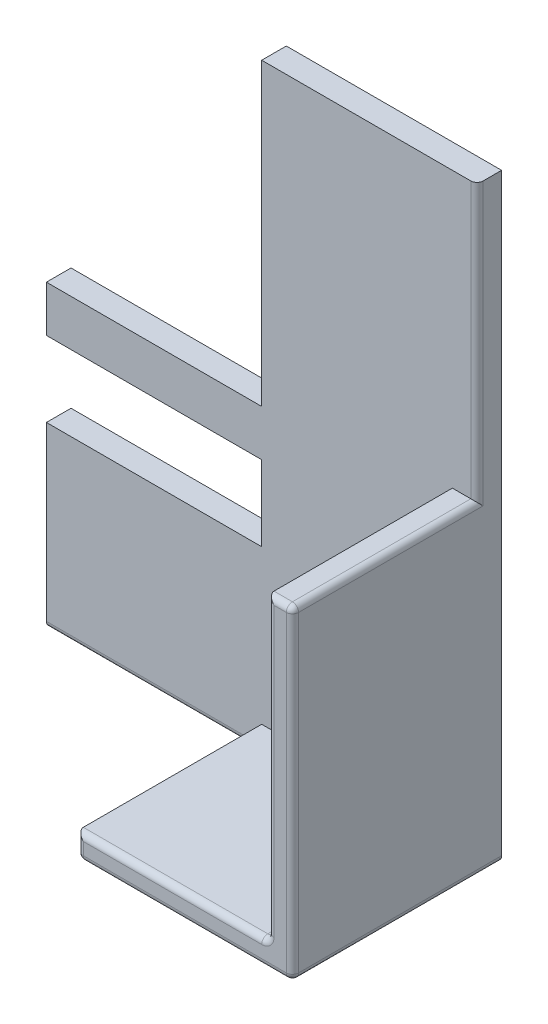
from build123d import *

# Parameters (mm, degrees)
EXTRUDE_1_DEPTH     = 8
CUT_EXTRUDE_1_DEPTH = 2
SKETCH_3_R          = 2
CUT_EXTRUDE_2_DEPTH = 5
SKETCH_4_W          = 8
SKETCH_4_H          = 97.5
EXTRUDE_2_DEPTH     = 60
FILLET_1_R          = 2
SKETCH_5_W          = 70
SKETCH_5_H          = 24.5
CUT_EXTRUDE_4_DEPTH = 20


with BuildPart() as part:
    # 스케치1 → 보스-돌출1 (new body)
    with BuildSketch(Plane.XY):
        Polygon((0, 0), (70, 0), (70, 97.5), (140, 97.5), (140, -19.573170732), (140, -97.5), (0, -97.5), align=None)
    extrude(amount=EXTRUDE_1_DEPTH)

    # 스케치2 → 컷-돌출1 (cut)
    with BuildSketch(Plane.XY):
        Polygon((127.5, 90.5), (129.25, 87.468911087), (132.75, 87.468911087), (134.5, 90.5), (132.75, 93.531088913), (129.25, 93.531088913), align=None)
        Polygon((129.25, -7.031088913), (132.75, -7.031088913), (134.5, -4), (132.75, -0.968911087), (129.25, -0.968911087), (127.5, -4), align=None)
        Polygon((136.5, -87.08), (134.75, -84.048911087), (131.25, -84.048911087), (129.5, -87.08), (131.25, -90.111088913), (134.75, -90.111088913), align=None)
        Polygon((83.25, -77.468911087), (81.5, -80.5), (83.25, -83.531088913), (86.75, -83.531088913), (88.5, -80.5), (86.75, -77.468911087), align=None)
        Polygon((83.25, -87.468911087), (81.5, -90.5), (83.25, -93.531088913), (86.75, -93.531088913), (88.5, -90.5), (86.75, -87.468911087), align=None)
        Polygon((37.25, -7.001775013), (40.75, -7.001775013), (42.5, -3.9706861), (40.75, -0.939597187), (37.25, -0.939597187), (35.5, -3.9706861), align=None)
    extrude(amount=CUT_EXTRUDE_1_DEPTH, mode=Mode.SUBTRACT)

    # 스케치3 → 컷-돌출2 (cut)
    with BuildSketch(Plane.XY.offset(2)):
        with Locations((130.98963708, 90.501088913)):
            Circle(SKETCH_3_R)
        with Locations((131.01036292, -3.998911087)):
            Circle(SKETCH_3_R)
        with Locations((39.010362751, -3.969597187)):
            Circle(SKETCH_3_R)
        with Locations((85.01036292, -80.498911087)):
            Circle(SKETCH_3_R)
        with Locations((84.989637249, -90.501088913)):
            Circle(SKETCH_3_R)
        with Locations((132.98963708, -87.078911087)):
            Circle(SKETCH_3_R)
    extrude(amount=CUT_EXTRUDE_2_DEPTH, mode=Mode.SUBTRACT)

    # 스케치4 → 보스-돌출2 (add)
    with BuildSketch(Plane.XY.offset(8)):
        with Locations((136, -40.75)):
            Rectangle(SKETCH_4_W, SKETCH_4_H)
        Polygon((70, -97.5), (140, -97.5), (140, -89.5), (132, -89.5), (70, -89.5), align=None)
    extrude(amount=EXTRUDE_2_DEPTH)

    # 필렛1
    fillet_1_edges = [part.edges().sort_by_distance(p)[0] for p in [
        (140, -97.5, 34),
        (140, 52.75, 8),
        (132, -40.75, 68),
        (132, -89.5, 38),
        (70, -93.5, 68),
        (70, -97.5, 38),
        (140, 8, 38),
        (101, -89.5, 68),
        (105, -97.5, 68),
        (140, -44.75, 68),
        (136, 8, 68),
        (35, -97.5, 8),
    ]]
    fillet(fillet_1_edges, radius=FILLET_1_R)

    # 스케치5 → 컷-돌출4 (cut)
    with BuildSketch(Plane.XY.offset(8)):
        with Locations((35, -27.25)):
            Rectangle(SKETCH_5_W, SKETCH_5_H)
    extrude(amount=-CUT_EXTRUDE_4_DEPTH, mode=Mode.SUBTRACT)


solid = part.part
